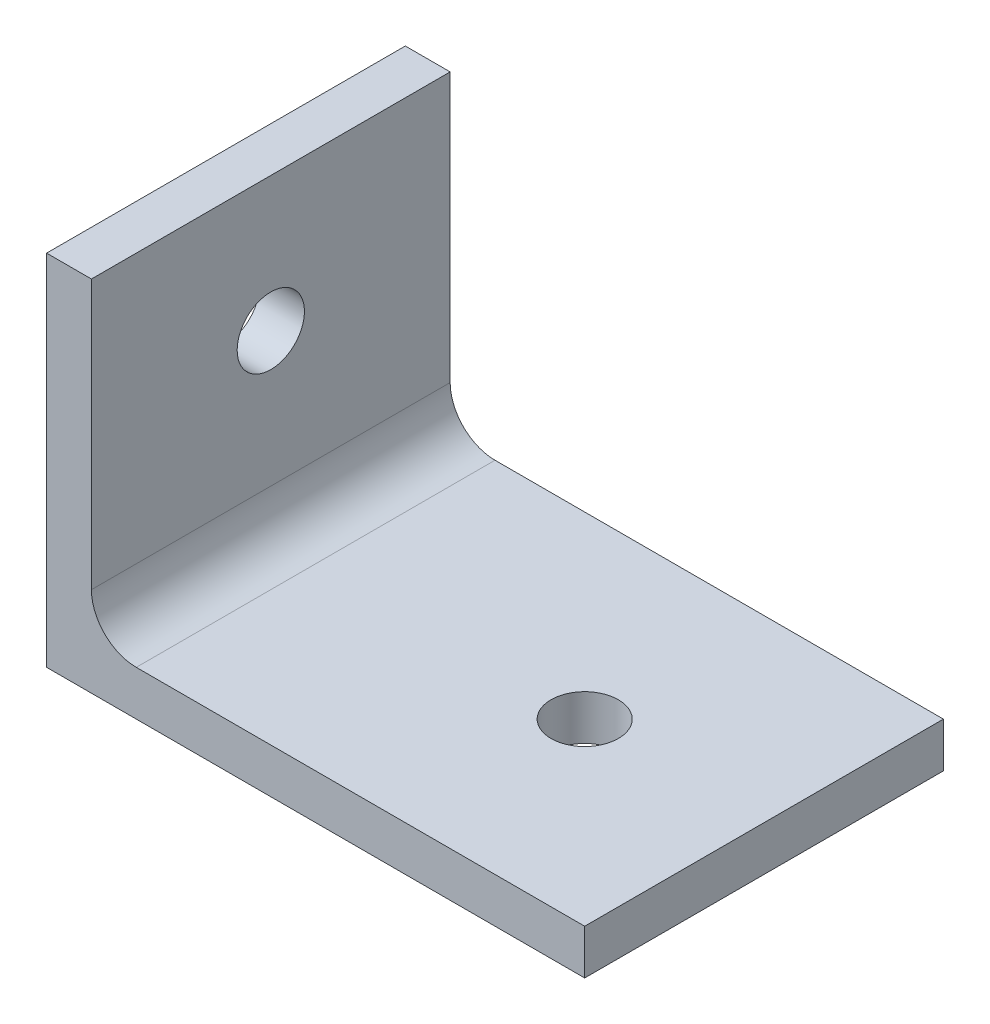
from build123d import *

# Parameters (mm, degrees)
BRACKET_DEPTH      = 25.4
FILLET_2_R         = 6.35
SKETCH2_R          = 4.7625
BASE_HOLE_DEPTH    = 92.800885072
SKETCH4_R          = 4.7625
CUT_EXTRUDE2_DEPTH = 96.038097624


with BuildPart() as part:
    # Sketch1 → Bracket (new, symmetric)
    with BuildSketch(Plane.XY):
        Polygon((0, 0), (76.2, 0), (76.2, 6.35), (6.35, 6.35), (6.35, 50.8), (0, 50.8), align=None)
    extrude(amount=BRACKET_DEPTH, both=True)

    # Fillet 2
    fillet_2_edges = [part.edges().sort_by_distance(p)[0] for p in [
        (6.35, 6.35, 0),
    ]]
    fillet(fillet_2_edges, radius=FILLET_2_R)

    # Sketch2 → Base hole (cut, through all)
    with BuildSketch(Plane(origin=(0, 6.35, 0), x_dir=(1, 0, 0), z_dir=(0, 1, 0))):
        with Locations(Location((50.8, 0, 0), (0, 0, 180))):
            Circle(SKETCH2_R)
    extrude(amount=-BASE_HOLE_DEPTH, mode=Mode.SUBTRACT)

    # Sketch4 → Cut-Extrude2 (cut, through all)
    with BuildSketch(Plane.ZY):
        with Locations((0, 31.75)):
            Circle(SKETCH4_R)
    extrude(amount=-CUT_EXTRUDE2_DEPTH, mode=Mode.SUBTRACT)


solid = part.part
